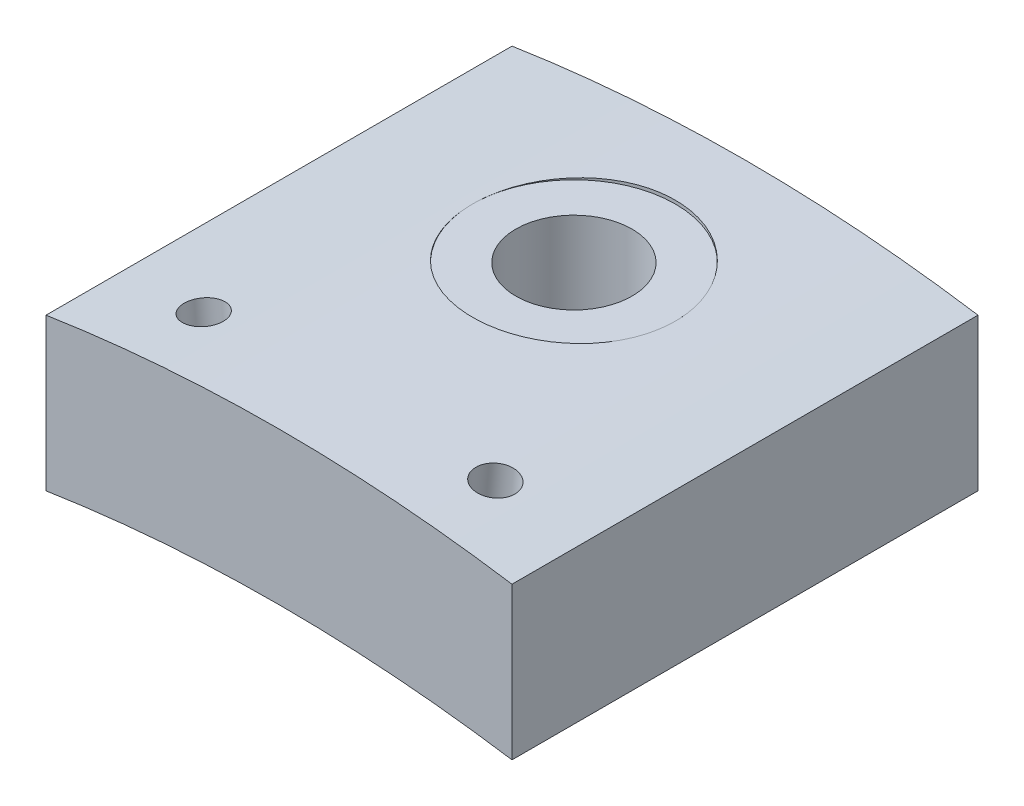
from build123d import *

# Parameters (mm, degrees)
BOSS_EXTRUDE1_DEPTH     = 35
CUT_EXTRUDE4_DEPTH      = 52.815716631
CUT_EXTRUDE4_DEPTH_BACK = 52.815716631
SKETCH6_R               = 1.4732
CUT_EXTRUDE5_DEPTH      = 53.815781867
CUT_EXTRUDE5_DEPTH_BACK = 53.815781867
SKETCH7_R               = 1.4732
CUT_EXTRUDE6_DEPTH      = 54.018864735
SKETCH9_R               = 3
CUT_EXTRUDE7_DEPTH      = 42.163897972
SKETCH9_3_R             = 4.365625
SKETCH9_3_R_2           = 3
CUT_EXTRUDE8_DEPTH      = 8.255
SKETCH9_4_R             = 7.62
SKETCH9_4_R_2           = 4.365625
CUT_EXTRUDE9_DEPTH      = 0.254


with BuildPart() as part:
    # Sketch1 → Boss-Extrude1 (new body)
    with BuildSketch(Plane.XY):
        with BuildLine():
            Line((0, -19), (0, 0))
            Line((0, 0), (-35, 0))
            Line((-35, 0), (-35, -19))
            ThreePointArc((-35, -19), (-17.5, -17.653892856), (0, -19))
        make_face()
    extrude(amount=BOSS_EXTRUDE1_DEPTH)

    # Sketch6 → Cut-Extrude4 (cut, two sides: drawn at the far end of the back side and taken through both)
    with BuildSketch(Plane(origin=(-1.62776516, -18.605440918, 0), x_dir=(0.9961946980917455, -0.08715574274765824, 0), z_dir=(-0.08715574274765824, -0.9961946980917455, 0)).offset(-CUT_EXTRUDE4_DEPTH_BACK)):
        with Locations((-5.932999587, 29.70276)):
            Circle(SKETCH6_R)
    extrude(amount=CUT_EXTRUDE4_DEPTH + CUT_EXTRUDE4_DEPTH_BACK, mode=Mode.SUBTRACT)

    # Sketch7 → Cut-Extrude5 (cut, two sides: drawn at the far end of the back side and taken through both)
    with BuildSketch(Plane(origin=(1.361900838, -15.566597809, 0), x_dir=(0.9961946980917455, 0.08715574274765851, 0), z_dir=(0.08715574274765851, -0.9961946980917455, 0)).offset(-CUT_EXTRUDE5_DEPTH_BACK)):
        with Locations((-28.933814846, 29.70276)):
            Circle(SKETCH7_R)
    extrude(amount=CUT_EXTRUDE5_DEPTH + CUT_EXTRUDE5_DEPTH_BACK, mode=Mode.SUBTRACT)

    # Sketch8 → Cut-Extrude6 (cut, through all)
    with BuildSketch(Plane(origin=(0, 0, 0), x_dir=(-1, 0, 0), z_dir=(0, 0, -1))):
        with BuildLine():
            ThreePointArc((0, -7.571999996), (17.5, -6.224379342), (35, -7.571999996))
            Line((35, -7.571999996), (35, 0))
            Line((35, 0), (0, 0))
            Line((0, 0), (0, -7.571999996))
        make_face()
    extrude(amount=-CUT_EXTRUDE6_DEPTH, mode=Mode.SUBTRACT)

    # Sketch9 → Cut-Extrude7 (cut, through all)
    with BuildSketch(Plane(origin=(-17.5, -6.224379342, 0), x_dir=(-1, 0, 0), z_dir=(0, 1, 0))):
        with Locations((0, 12.85)):
            Circle(SKETCH9_R)
    extrude(amount=-CUT_EXTRUDE7_DEPTH, mode=Mode.SUBTRACT)

    # Sketch9<3> → Cut-Extrude8 (cut)
    with BuildSketch(Plane(origin=(-17.5, -6.224379342, 0), x_dir=(-1, 0, 0), z_dir=(0, 1, 0))):
        with Locations((0, 12.85)):
            Circle(SKETCH9_3_R)
        with Locations((0, 12.85)):
            Circle(SKETCH9_3_R_2, mode=Mode.SUBTRACT)
    extrude(amount=-CUT_EXTRUDE8_DEPTH, mode=Mode.SUBTRACT)

    # Sketch9<4> → Cut-Extrude9 (cut)
    with BuildSketch(Plane(origin=(-17.5, -6.224379342, 0), x_dir=(-1, 0, 0), z_dir=(0, 1, 0))):
        with Locations((0, 12.85)):
            Circle(SKETCH9_4_R)
        with Locations((0, 12.85)):
            Circle(SKETCH9_4_R_2, mode=Mode.SUBTRACT)
    extrude(amount=-CUT_EXTRUDE9_DEPTH, mode=Mode.SUBTRACT)


solid = part.part
